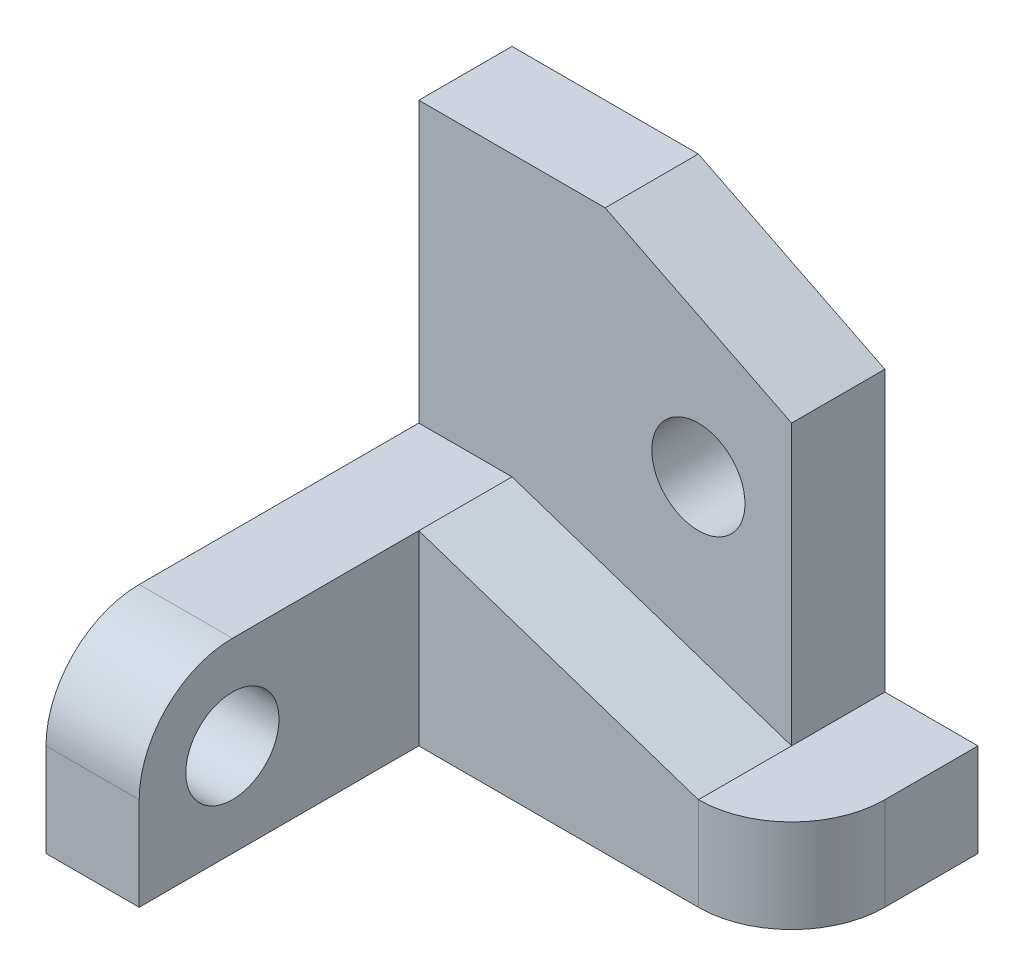
from build123d import *

# Parameters (mm, degrees)
SKETCH_1_R      = 2.5
EXTRUDE_1_DEPTH = 5
EXTRUDE_2_DEPTH = 5
EXTRUDE_3_REACH = 38.742
SKETCH_3_W      = 20
SKETCH_3_H      = 10
SKETCH_3_R      = 2.5
FILLET_1_R      = 5
SKETCH_4_W      = 5
SKETCH_4_H      = 5
EXTRUDE_4_DEPTH = 5
FILLET_2_R      = 5


with BuildPart() as part:
    # 草圖1 → 填料-伸長1 (new body)
    with BuildSketch(Plane.XY):
        Polygon((-10, 25), (0, 20), (0, 0), (-20, 0), (-20, 25), align=None)
        with Locations((-5, 15)):
            Circle(SKETCH_1_R, mode=Mode.SUBTRACT)
    extrude(amount=EXTRUDE_1_DEPTH)

    # 草圖2 → 填料-伸長2 (add)
    with BuildSketch(Plane.XY.offset(5)):
        Polygon((-15, 10), (0, 5), (5, 5), (5, 0), (-15, 0), align=None)
    extrude(amount=EXTRUDE_2_DEPTH)

    # 填料-伸長3: up to this face of the body (flat: up to its plane)
    extrude_3_end = Plane(part.part.faces().sort_by_distance((-15, 5, 7.5))[0])
    # 草圖3 → 填料-伸長3 (add, up to the picked face)
    with BuildSketch(Plane.ZY.offset(20), mode=Mode.PRIVATE) as extrude_3_sk1:
        with Locations((15, 5)):
            Rectangle(SKETCH_3_W, SKETCH_3_H)
        with Locations((20, 5)):
            Circle(SKETCH_3_R, mode=Mode.SUBTRACT)
    extrude_3_tool1 = split(extrude(extrude_3_sk1.sketch, amount=-EXTRUDE_3_REACH, mode=Mode.PRIVATE), bisect_by=extrude_3_end, keep=Keep.BOTH, mode=Mode.PRIVATE)
    add(extrude_3_tool1.solids().sort_by(Axis((-20, 5, 14.455688), (1, 0, 0)))[0])

    # 圓角1
    fillet_1_edges = [part.edges().sort_by_distance(p)[0] for p in [
        (-17.5, 10, 25),
    ]]
    fillet(fillet_1_edges, radius=FILLET_1_R)

    # 草圖4 → 填料-伸長4 (add)
    with BuildSketch(Plane(origin=(0, 0, 5), x_dir=(-1, 0, 0), z_dir=(0, 0, -1))):
        with Locations((-2.5, 2.5)):
            Rectangle(SKETCH_4_W, SKETCH_4_H)
    extrude(amount=EXTRUDE_4_DEPTH)

    # 圓角2
    fillet_2_edges = [part.edges().sort_by_distance(p)[0] for p in [
        (5, 2.5, 10),
    ]]
    fillet(fillet_2_edges, radius=FILLET_2_R)


solid = part.part
